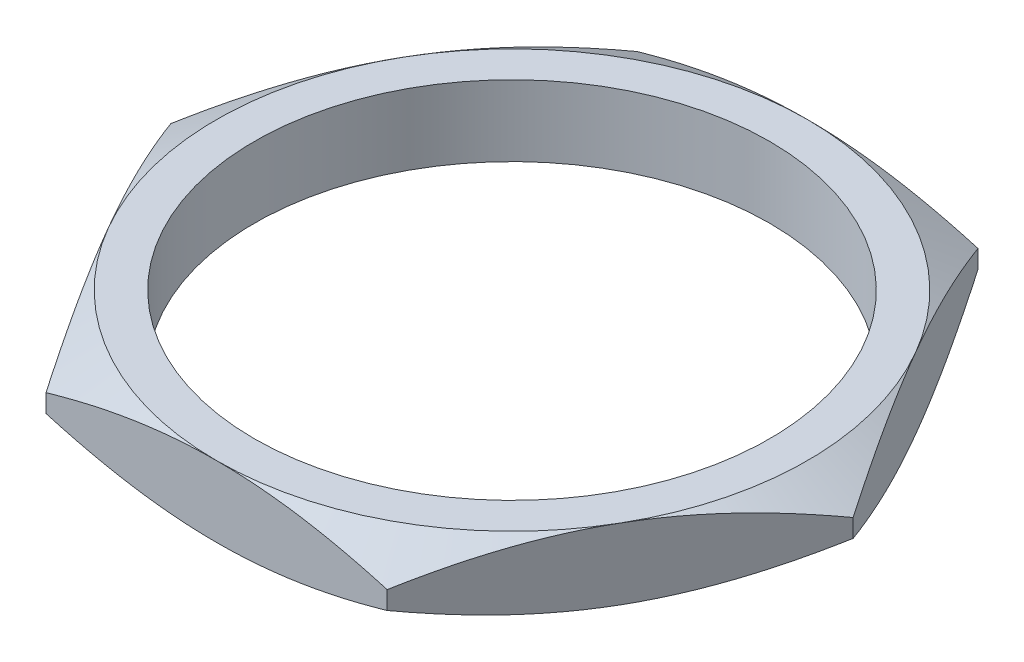
from build123d import *

# Parameters (mm, degrees)
SKETCH1_R               = 10.9
BOSS_EXTRUDE1_DEPTH     = 3
SKETCH2_OUTSIDE_W       = 108.948
SKETCH2_OUTSIDE_H       = 105.08
SKETCH2_OUTSIDE_R       = 12.5
CUT_EXTRUDE1_DEPTH      = 20.328303944
CUT_EXTRUDE1_DRAFT      = -60
MIRROR1_COPY_1_SKETCH_W = 108.948
MIRROR1_COPY_1_SKETCH_H = 105.08
MIRROR1_COPY_1_SKETCH_R = 12.5
MIRROR1_COPY_1_DEPTH    = 20.328303944
MIRROR1_COPY_1_DRAFT    = -60


with BuildPart() as part:
    # Sketch1 → Boss-Extrude1 (new body)
    with BuildSketch(Plane(origin=(0, 0, 0), x_dir=(1, 0, 0), z_dir=(0, 1, 0))):
        Polygon((14.43375673, 0), (7.216878365, 12.5), (-7.216878365, 12.5), (-14.43375673, 0), (-7.216878365, -12.5), (7.216878365, -12.5), align=None)
        with Locations(Location((0, 0, 0), (0, 0, 270))):
            Circle(SKETCH1_R, mode=Mode.SUBTRACT)
    extrude(amount=BOSS_EXTRUDE1_DEPTH)


with BuildPart() as cut_extrude1_tool:
    # Sketch2 outside → Cut-Extrude1 (with draft: the straight prism first)
    with BuildSketch(Plane(origin=(0, 3, 0), x_dir=(1, 0, 0), z_dir=(0, 1, 0))):
        Rectangle(SKETCH2_OUTSIDE_W, SKETCH2_OUTSIDE_H)
        Circle(SKETCH2_OUTSIDE_R, mode=Mode.SUBTRACT)
    extrude(amount=-CUT_EXTRUDE1_DEPTH)
    # Cut-Extrude1: the draft: its side faces are tilted about the plane it starts from
    cut_extrude1_sides = [cut_extrude1_tool.faces().sort_by_distance(p)[0] for p in [
        (0, -7.164151972, 52.54),
        (54.474, -7.164151972, 0),
        (0, -7.164151972, -52.54),
        (-54.474, -7.164151972, 0),
        (-12.5, -7.164151972, 0),
    ]]
    draft(cut_extrude1_sides, Plane(origin=(0, 3, 0), x_dir=(1, 0, 0), z_dir=(0, 1, 0)), CUT_EXTRUDE1_DRAFT)


with BuildPart() as part_1:
    add(part.part)

    # Cut-Extrude1: cut by cut_extrude1_tool
    add(cut_extrude1_tool.part, mode=Mode.SUBTRACT)


with BuildPart() as mirror1_copy_1_tool:
    # Mirror1 copy 1 sketch → Mirror1 copy 1 (with draft: the straight prism first)
    with BuildSketch(Plane.XZ):
        Rectangle(MIRROR1_COPY_1_SKETCH_W, MIRROR1_COPY_1_SKETCH_H)
        Circle(MIRROR1_COPY_1_SKETCH_R, mode=Mode.SUBTRACT)
    extrude(amount=-MIRROR1_COPY_1_DEPTH)
    # Mirror1 copy 1: the draft: its side faces are tilted about the plane it starts from
    mirror1_copy_1_sides = [mirror1_copy_1_tool.faces().sort_by_distance(p)[0] for p in [
        (0, 10.164151972, 52.54),
        (54.474, 10.164151972, 0),
        (0, 10.164151972, -52.54),
        (-54.474, 10.164151972, 0),
        (-12.5, 10.164151972, 0),
    ]]
    draft(mirror1_copy_1_sides, Plane.XZ, MIRROR1_COPY_1_DRAFT)


with BuildPart() as part_2:
    add(part_1.part)

    # Mirror1 copy 1: cut by mirror1_copy_1_tool
    add(mirror1_copy_1_tool.part, mode=Mode.SUBTRACT)


solid = part_2.part
